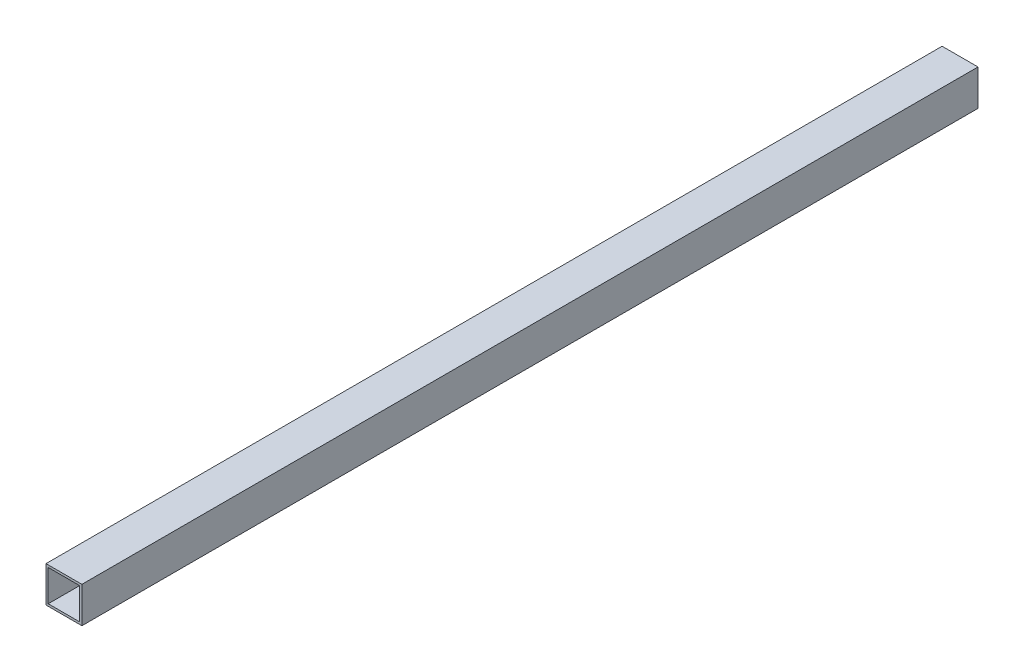
from build123d import *

# Parameters (mm, degrees)
CROQUIS1_W              = 76.2
CROQUIS1_H              = 76.2
CROQUIS1_W_2            = 66.675
CROQUIS1_H_2            = 66.675
SALIENTE_EXTRUIR1_DEPTH = 1902.4


with BuildPart() as part:
    # Croquis1 → Saliente-Extruir1 (new body)
    with BuildSketch(Plane.XY):
        with Locations((38.1, -38.1)):
            Rectangle(CROQUIS1_W, CROQUIS1_H)
        with Locations((38.1, -38.1)):
            Rectangle(CROQUIS1_W_2, CROQUIS1_H_2, mode=Mode.SUBTRACT)
    extrude(amount=SALIENTE_EXTRUIR1_DEPTH)


solid = part.part
